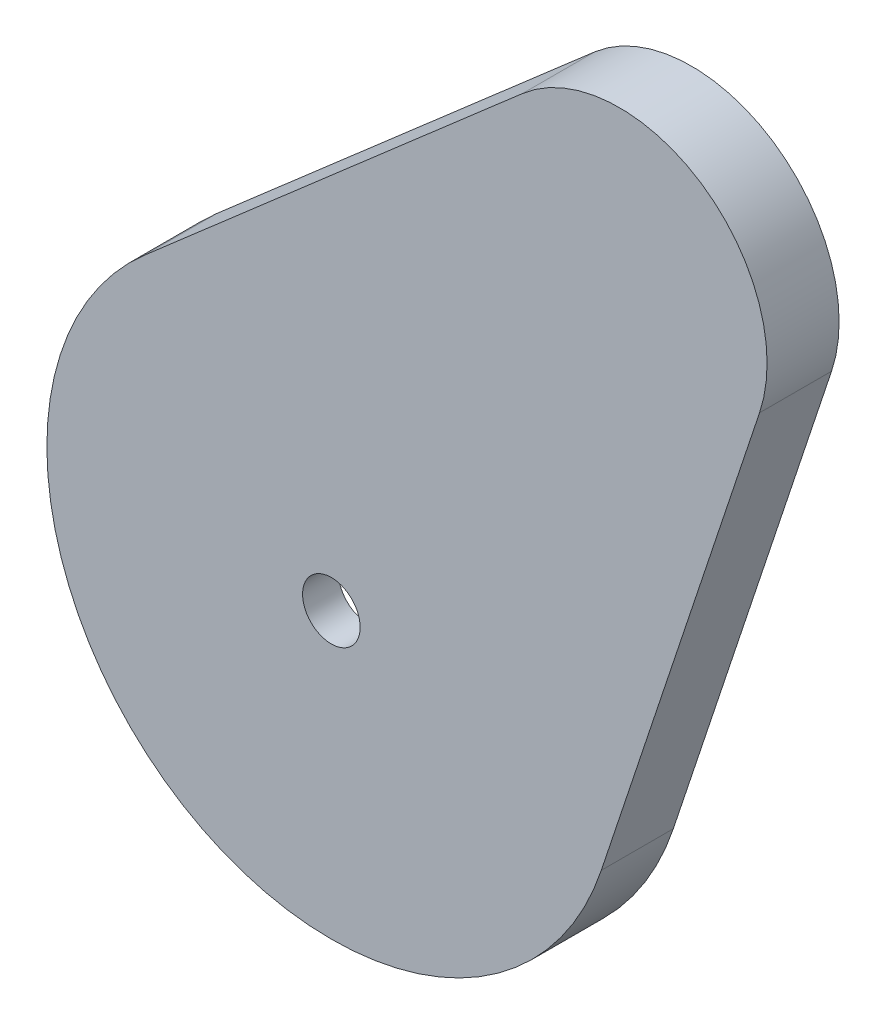
from build123d import *

# Parameters (mm, degrees)
BOSS_EXTRU_1_DEPTH      = 5
BOSS_EXTRU_2_DEPTH      = 5
ESQUISSE3_R             = 4
ENL_V_MAT_EXTRU_1_DEPTH = 5


with BuildPart() as part:
    # Esquisse1 → Boss.-Extru.1 (new body)
    with BuildSketch(Plane.XY):
        with BuildLine():
            Line((16.587839799, 53.843180126), (-35.88556985, 8.175453138))
            ThreePointArc((-35.88556985, 8.175453138), (-31.864665417, -54.486574909), (27.523708309, -34.097398918))
            Line((27.523708309, -34.097398918), (49.496452515, 31.904105008))
            ThreePointArc((49.496452515, 31.904105008), (41.417346329, 55.43644284), (16.587839799, 53.843180126))
        make_face()
        with BuildLine():
            Line((23.152792246, 46.299878504), (-29.320617403, 0.632151516))
            ThreePointArc((-29.320617403, 0.632151516), (-26.31766346, -46.166071962), (18.035678944, -30.938712678))
            Line((18.035678944, -30.938712678), (40.008423149, 35.062791248))
            ThreePointArc((40.008423149, 35.062791248), (35.870344371, 47.115939894), (23.152792246, 46.299878504))
        make_face(mode=Mode.SUBTRACT)
    extrude(amount=BOSS_EXTRU_1_DEPTH)

    # Esquisse2 → Boss.-Extru.2 (add)
    with BuildSketch(Plane.XY.offset(5)):
        with BuildLine():
            Line((16.587839799, 53.843180126), (-35.88556985, 8.175453138))
            ThreePointArc((-35.88556985, 8.175453138), (-31.864665417, -54.486574909), (27.523708309, -34.097398918))
            Line((27.523708309, -34.097398918), (49.496452515, 31.904105008))
            ThreePointArc((49.496452515, 31.904105008), (41.417346329, 55.43644284), (16.587839799, 53.843180126))
        make_face()
    extrude(amount=BOSS_EXTRU_2_DEPTH)

    # Esquisse3 → Enlèv. mat.-Extru.1 (cut)
    with BuildSketch(Plane.XY.offset(10)):
        with Locations((-9.954007684, -21.62058827)):
            Circle(ESQUISSE3_R)
    extrude(amount=-ENL_V_MAT_EXTRU_1_DEPTH, mode=Mode.SUBTRACT)


solid = part.part
